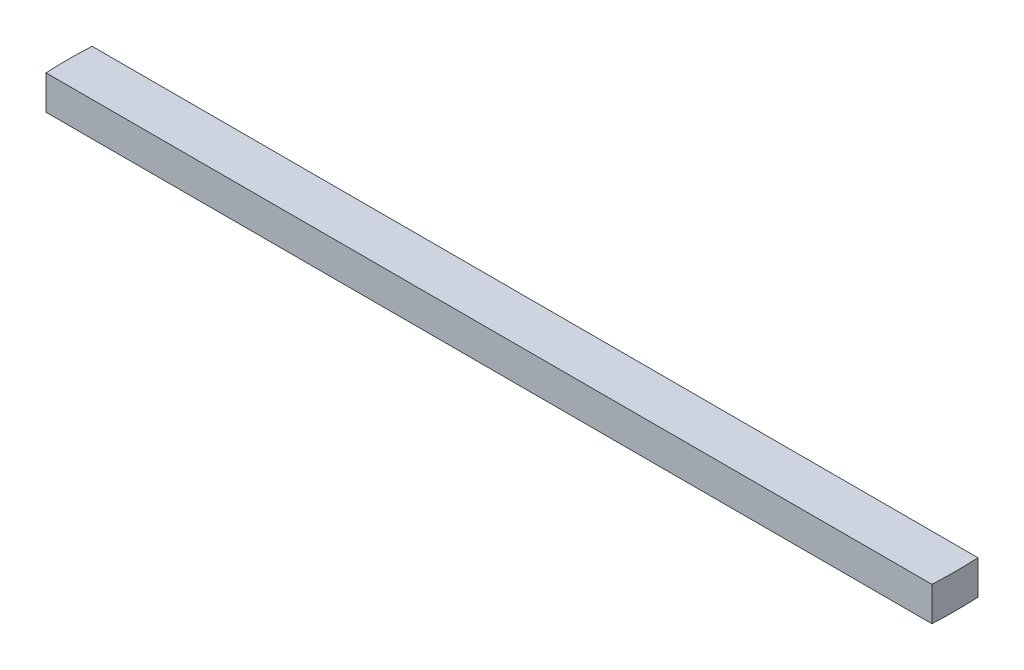
from build123d import *

# Parameters (mm, degrees)
BOSS_EXTRUDE1_DEPTH = 152.4


with BuildPart() as part:
    # Sketch1 → Boss-Extrude1 (new body)
    with BuildSketch(Plane(origin=(0, 0, 0), x_dir=(1, 0, 0), z_dir=(0, 1, 0))):
        with BuildLine():
            Line((-1978.526837554, 102.883395553), (1978.526837554, 102.883395553))
            ThreePointArc((1978.526837554, 102.883395553), (1981.2, 0), (1978.526837554, -102.883395553))
            Line((1978.526837554, -102.883395553), (-1978.526837554, -102.883395553))
            ThreePointArc((-1978.526837554, -102.883395553), (-1981.2, 0), (-1978.526837554, 102.883395553))
        make_face()
    extrude(amount=BOSS_EXTRUDE1_DEPTH)


solid = part.part
